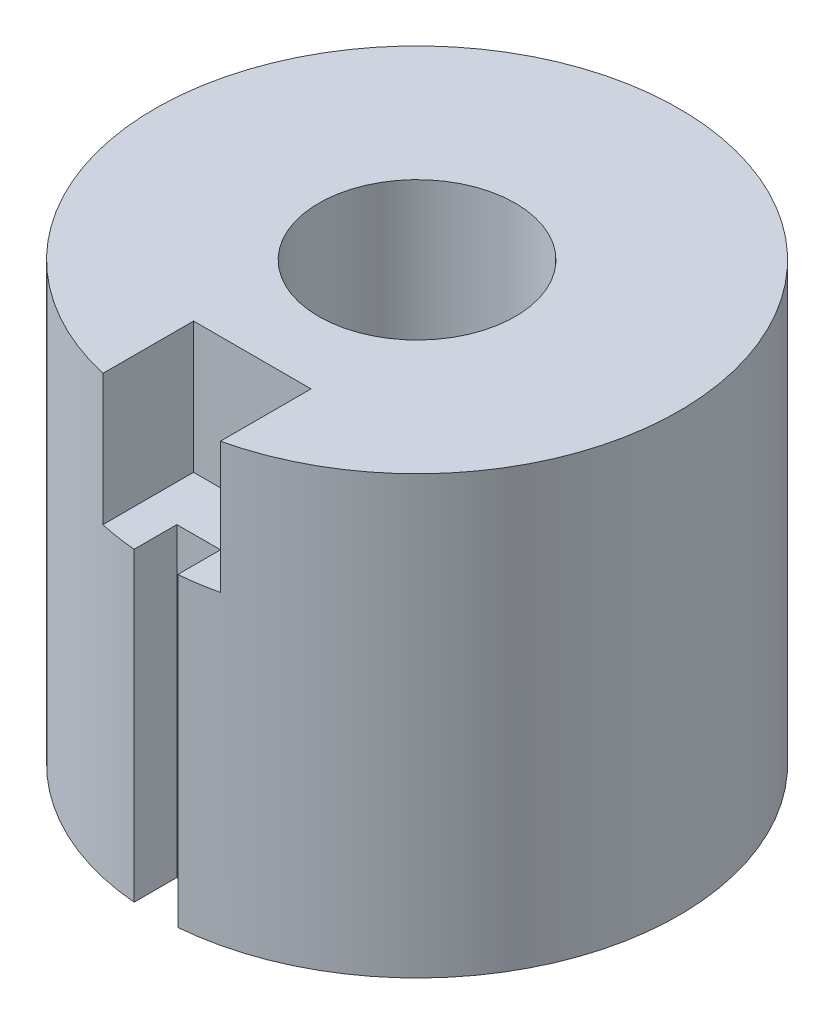
from build123d import *

# Parameters (mm, degrees)
ESQUISSE1_R             = 6
ESQUISSE1_R_2           = 2.25
BOSS_EXTRU_1_DEPTH      = 10
ESQUISSE2_W             = 1
ESQUISSE2_H             = 2
ENL_V_MAT_EXTRU_1_DEPTH = 20
ESQUISSE3_W             = 2.690646438
ESQUISSE3_H             = 2.455091602
ENL_V_MAT_EXTRU_2_DEPTH = 3


with BuildPart() as part:
    # Esquisse1 → Boss.-Extru.1 (new body)
    with BuildSketch(Plane(origin=(0, 0, 0), x_dir=(1, 0, 0), z_dir=(0, 1, 0))):
        with Locations(Location((0, 0, 0), (0, 0, 270))):
            Circle(ESQUISSE1_R)
        with Locations(Location((0, 0, 0), (0, 0, 270))):
            Circle(ESQUISSE1_R_2, mode=Mode.SUBTRACT)
    extrude(amount=BOSS_EXTRU_1_DEPTH)

    # Esquisse2 → Enlèv. mat.-Extru.1 (cut)
    with BuildSketch(Plane(origin=(0, 10, 0), x_dir=(1, 0, 0), z_dir=(0, 1, 0))):
        with Locations((0, -6)):
            Rectangle(ESQUISSE2_W, ESQUISSE2_H)
    extrude(amount=-ENL_V_MAT_EXTRU_1_DEPTH, mode=Mode.SUBTRACT)

    # Esquisse3 → Enlèv. mat.-Extru.2 (cut)
    with BuildSketch(Plane(origin=(0, 10, 0), x_dir=(1, 0, 0), z_dir=(0, 1, 0))):
        with Locations((0, -5)):
            Rectangle(ESQUISSE3_W, ESQUISSE3_H)
    extrude(amount=-ENL_V_MAT_EXTRU_2_DEPTH, mode=Mode.SUBTRACT)


solid = part.part
